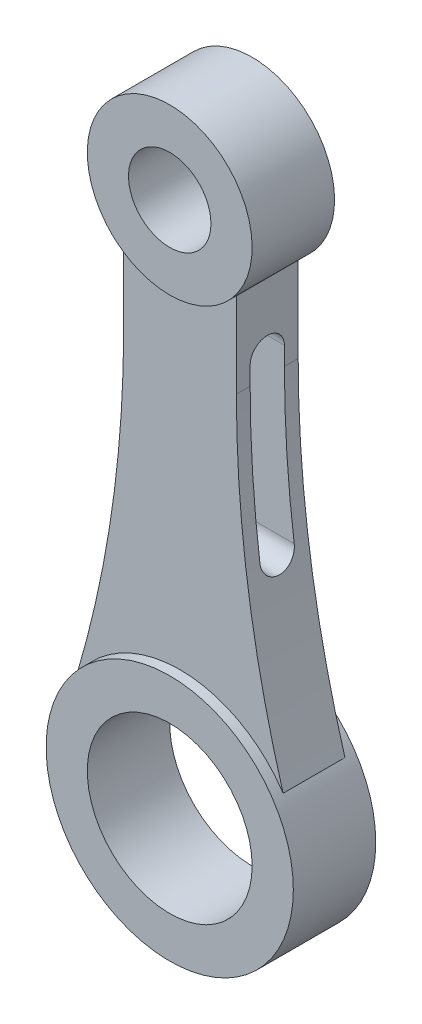
from build123d import *

# Parameters (mm, degrees)
SKETCH1_R               = 10
BOSS_EXTRUDE1_DEPTH     = 10
SKETCH1_R_2             = 30
SKETCH1_R_3             = 20
BOSS_EXTRUDE1_2_DEPTH   = 10
BOSS_EXTRUDE4_DEPTH     = 7.5
CUT_EXTRUDE1_DEPTH      = 114.433192588
CUT_EXTRUDE1_DEPTH_BACK = 117.433192588
CUT_EXTRUDE1_START      = 3
CUT_EXTRUDE2_START      = -5
CUT_EXTRUDE2_DEPTH      = 0.5


with BuildPart() as part:
    # Sketch1 → Boss-Extrude1 (new, symmetric)
    with BuildSketch(Plane.XY):
        with BuildLine():
            Line((-13.680465752, 36.474626355), (-13.367378576, 36.187231049))
            ThreePointArc((-13.367378576, 36.187231049), (13.524685568, 65.797562521), (-13.680465752, 36.474626355))
        make_face()
        with Locations((0, 51.063829787)):
            Circle(SKETCH1_R, mode=Mode.SUBTRACT)
    extrude(amount=BOSS_EXTRUDE1_DEPTH, both=True)


with BuildPart() as body_2:
    # Sketch1 → Boss-Extrude1 2 (new, symmetric)
    with BuildSketch(Plane.XY):
        with Locations((0, -78.936170213)):
            Circle(SKETCH1_R_2)
        with Locations((0, -78.936170213)):
            Circle(SKETCH1_R_3, mode=Mode.SUBTRACT)
    extrude(amount=BOSS_EXTRUDE1_2_DEPTH, both=True)


with BuildPart() as body_3:
    # Sketch1<4> → Boss-Extrude4 (new, symmetric)
    with BuildSketch(Plane.XY):
        with BuildLine():
            ThreePointArc((13.680465752, 36.474626355), (0.212496848, 31.064958692), (-13.367378576, 36.187231049))
            ThreePointArc((-13.367378576, 36.187231049), (-13.524685568, 36.330097053), (-13.680465752, 36.474626355))
            Line((-13.680465752, 36.474626355), (-13.680465752, 15.820153121))
            ThreePointArc((-13.680465752, 15.820153121), (-16.530963998, -23.693273772), (-25.023427937, -62.38841948))
            ThreePointArc((-25.023427937, -62.38841948), (0, -48.936170213), (25.023427937, -62.38841948))
            ThreePointArc((25.023427937, -62.38841948), (16.530963998, -23.693273772), (13.680465752, 15.820153121))
            Line((13.680465752, 15.820153121), (13.680465752, 36.474626355))
        make_face()
    extrude(amount=BOSS_EXTRUDE4_DEPTH, both=True)

    # Sketch2 → Cut-Extrude1 (cut, two sides: drawn at the far end of the back side and taken through both)
    with BuildSketch(Plane(origin=(0, 0, 0), x_dir=(0, 0, -1), z_dir=(1, 0, 0)).offset(CUT_EXTRUDE1_START - CUT_EXTRUDE1_DEPTH_BACK)):
        with BuildLine():
            Line((4.156679083, 20.258749921), (4.156679083, -20.258749921))
            ThreePointArc((4.156679083, -20.258749921), (0, -24.415429004), (-4.156679083, -20.258749921))
            Line((-4.156679083, -20.258749921), (-4.156679083, 20.258749921))
            ThreePointArc((-4.156679083, 20.258749921), (0, 24.415429004), (4.156679083, 20.258749921))
        make_face()
    extrude(amount=CUT_EXTRUDE1_DEPTH + CUT_EXTRUDE1_DEPTH_BACK, mode=Mode.SUBTRACT)

    # Sketch3 → Cut-Extrude2 (cut, symmetric)
    with BuildSketch(Plane.XY.offset(CUT_EXTRUDE2_START)):
        with BuildLine():
            Line((6.703065473, 0), (6.703065473, -18.550593617))
            ThreePointArc((6.703065473, -18.550593617), (0, -25.25365909), (-6.703065473, -18.550593617))
            Line((-6.703065473, -18.550593617), (-6.703065473, 0))
            ThreePointArc((-6.703065473, 0), (0, 6.703065473), (6.703065473, 0))
        make_face()
    extrude(amount=CUT_EXTRUDE2_DEPTH, both=True, mode=Mode.SUBTRACT)


solid = Compound([part.part, body_2.part, body_3.part])
